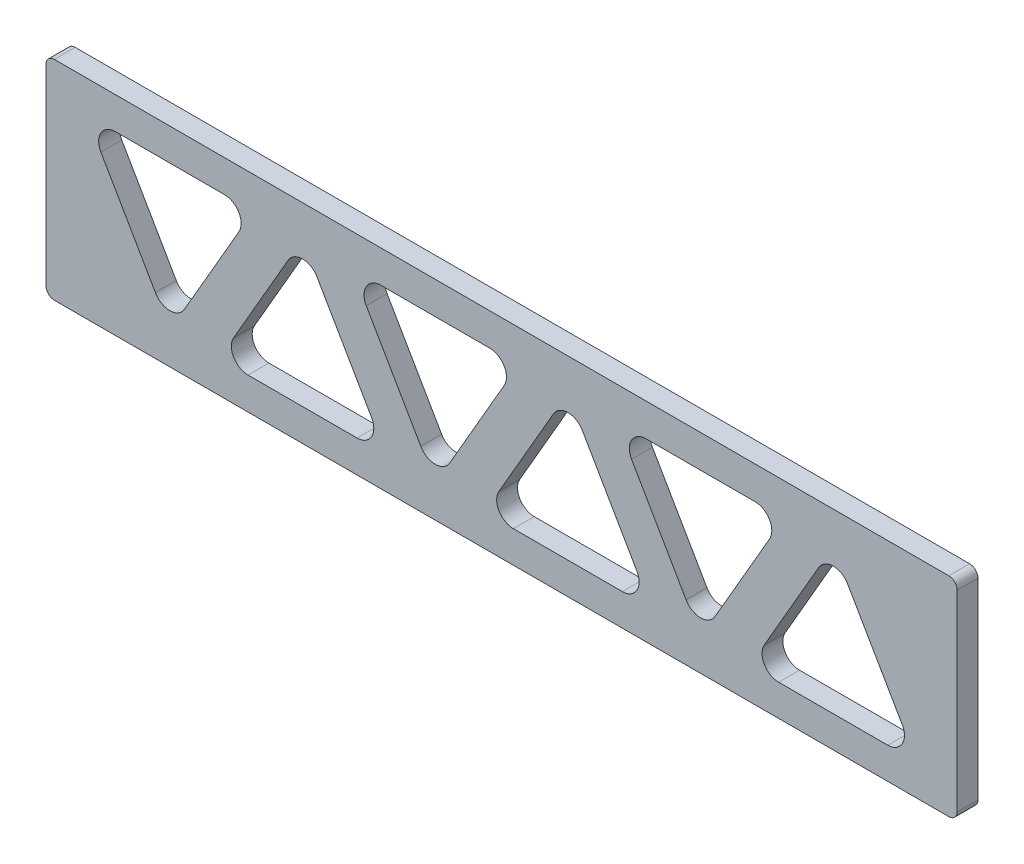
from build123d import *

# Parameters (mm, degrees)
BOSS_EXTRUDE1_DEPTH = 6.35
FILLET1_R           = 5.08


with BuildPart() as part:
    # Sketch2 → Boss-Extrude1 (new body)
    with BuildSketch(Plane.XY):
        with BuildLine():
            Line((-5.12438972, 14.653837172), (267.16361028, 14.653837172))
            ThreePointArc((267.16361028, 14.653837172), (268.959661504, 15.397785947), (269.70361028, 17.193837172))
            Line((269.70361028, 17.193837172), (269.70361028, 75.613837172))
            ThreePointArc((269.70361028, 75.613837172), (268.959661504, 77.409888396), (267.16361028, 78.153837172))
            Line((267.16361028, 78.153837172), (-5.12438972, 78.153837172))
            ThreePointArc((-5.12438972, 78.153837172), (-6.920440944, 77.409888396), (-7.66438972, 75.613837172))
            Line((-7.66438972, 75.613837172), (-7.66438972, 17.193837172))
            ThreePointArc((-7.66438972, 17.193837172), (-6.920440944, 15.397785947), (-5.12438972, 14.653837172))
        make_face()
        Polygon((30.05461028, 24.406794359), (4.65461028, 68.400884872), (55.45461028, 68.400884872), align=None, mode=Mode.SUBTRACT)
        Polygon((70.44061028, 68.400882428), (95.84061028, 24.406791915), (45.04061028, 24.406791915), align=None, mode=Mode.SUBTRACT)
        Polygon((110.82627023, 24.305837172), (85.42627023, 68.299927684), (136.22627023, 68.299927684), align=None, mode=Mode.SUBTRACT)
        Polygon((125.81227023, 24.305834728), (151.21227023, 68.29992524), (176.61227023, 24.305834728), align=None, mode=Mode.SUBTRACT)
        Polygon((191.59793018, 24.204879984), (166.19793018, 68.198970496), (216.99793018, 68.198970496), align=None, mode=Mode.SUBTRACT)
        Polygon((206.58393018, 24.20487754), (231.98393018, 68.198968052), (257.38393018, 24.20487754), align=None, mode=Mode.SUBTRACT)
    extrude(amount=BOSS_EXTRUDE1_DEPTH)

    # Fillet1
    fillet1_edges = [part.edges().sort_by_distance(p)[0] for p in [
        (257.38393018, 24.20487754, 3.175),
        (231.98393018, 68.198968052, 3.175),
        (206.58393018, 24.20487754, 3.175),
        (176.61227023, 24.305834728, 3.175),
        (151.21227023, 68.29992524, 3.175),
        (125.81227023, 24.305834728, 3.175),
        (4.65461028, 68.400884872, 3.175),
        (30.05461028, 24.406794359, 3.175),
        (55.45461028, 68.400884872, 3.175),
        (95.84061028, 24.406791915, 3.175),
        (70.44061028, 68.400882428, 3.175),
        (45.04061028, 24.406791915, 3.175),
        (85.42627023, 68.299927684, 3.175),
        (110.82627023, 24.305837172, 3.175),
        (136.22627023, 68.299927684, 3.175),
        (166.19793018, 68.198970496, 3.175),
        (191.59793018, 24.204879984, 3.175),
        (216.99793018, 68.198970496, 3.175),
    ]]
    fillet(fillet1_edges, radius=FILLET1_R)


solid = part.part
